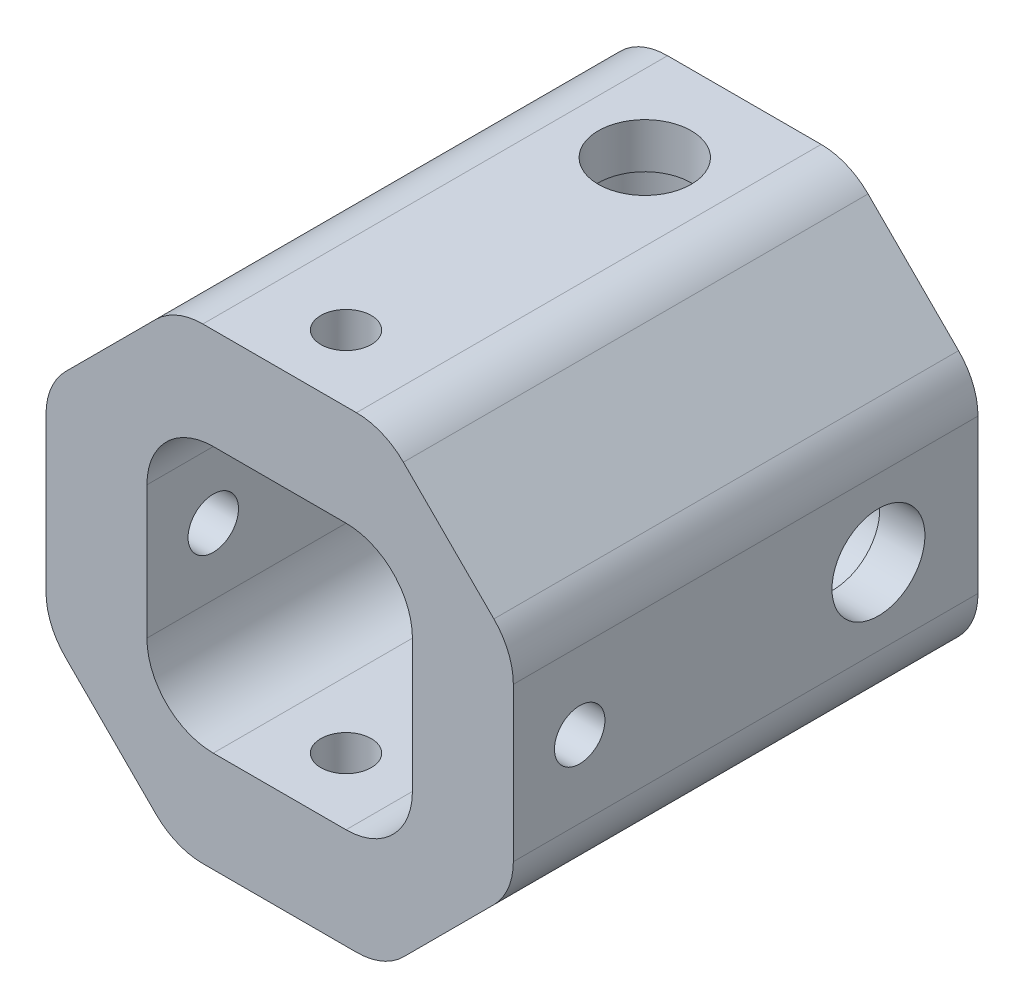
from build123d import *

# Parameters (mm, degrees)
EXTRUDE_1_DEPTH          = 7.5
CUT_EXTRUDE_1_DEPTH      = 30.546573405
CUT_EXTRUDE_1_DEPTH_BACK = 30.546573405
SKETCH_2_W               = 20
SKETCH_2_H               = 20
SKETCH_11_W              = 29.504788154
SKETCH_11_H              = 47.493911142
CUT_EXTRUDE_7_DEPTH      = 0.4
SKETCH_12_W              = 20.237973212
SKETCH_12_H              = 25.719397838
CUT_EXTRUDE_8_DEPTH      = 0.4
FILLET_1_R               = 5
FILLET_2_R               = 5
CUT_EXTRUDE_2_DEPTH      = 41.063075269
CUT_EXTRUDE_2_DEPTH_BACK = 41.063075269
SKETCH_3_R               = 4.2
CUT_EXTRUDE_3_DEPTH      = 41.063075269
CUT_EXTRUDE_3_DEPTH_BACK = 41.063075269
SKETCH_4_R               = 4.2
EXTRUDE_2_DEPTH          = 20
SKETCH_6_R               = 4.2
SKETCH_6_R_2             = 3.5
EXTRUDE_3_DEPTH          = 3.4
EXTRUDE_START            = -3.4
SKETCH_13_R              = 4.2
SKETCH_13_R_2            = 3.5
EXTRUDE_4_DEPTH          = 3.4
SKETCH_14_R              = 1.9
CUT_EXTRUDE_9_DEPTH      = 49.010936254
SKETCH_15_R              = 1.9
CUT_EXTRUDE_10_DEPTH     = 49.010936254


with BuildPart() as part:
    # ｽｹｯﾁ1 → ﾎﾞｽ - 押し出し1 (new, symmetric)
    with BuildSketch(Plane.XY):
        Polygon((7.455844123, -18), (18, -7.455844123), (18, 7.455844123), (7.455844123, 18), (-7.455844123, 18), (-18, 7.455844123), (-18, -7.455844123), (-7.455844123, -18), align=None)
    extrude(amount=EXTRUDE_1_DEPTH, both=True)

    # ｽｹｯﾁ2 → ｶｯﾄ - 押し出し1 (cut, two sides: drawn at the far end of the back side and taken through both)
    with BuildSketch(Plane.XY.offset(7.5).offset(-CUT_EXTRUDE_1_DEPTH_BACK)):
        Rectangle(SKETCH_2_W, SKETCH_2_H)
    extrude(amount=CUT_EXTRUDE_1_DEPTH + CUT_EXTRUDE_1_DEPTH_BACK, mode=Mode.SUBTRACT)

    # ｽｹｯﾁ11 → ｶｯﾄ - 押し出し7 (cut)
    with BuildSketch(Plane(origin=(0, 18, 0), x_dir=(1, 0, 0), z_dir=(0, 1, 0))):
        Rectangle(SKETCH_11_W, SKETCH_11_H)
    cut_extrude_7 = extrude(amount=-CUT_EXTRUDE_7_DEPTH, mode=Mode.SUBTRACT)

    # ﾐﾗｰ1: ｶｯﾄ - 押し出し7 across plane
    add(cut_extrude_7.mirror(Plane.ZX), mode=Mode.SUBTRACT)

    # ｽｹｯﾁ12 → ｶｯﾄ - 押し出し8 (cut)
    with BuildSketch(Plane.ZY.offset(18)):
        Rectangle(SKETCH_12_W, SKETCH_12_H)
    cut_extrude_8 = extrude(amount=-CUT_EXTRUDE_8_DEPTH, mode=Mode.SUBTRACT)

    # ﾐﾗｰ2: ｶｯﾄ - 押し出し8 across plane
    add(cut_extrude_8.mirror(Plane(origin=(0, 0, 0), x_dir=(0, 0, 1), z_dir=(1, 0, 0))), mode=Mode.SUBTRACT)

    # ﾌｨﾚｯﾄ1
    fillet_1_edges = [part.edges().sort_by_distance(p)[0] for p in [
        (-10, -10, 0),
        (-10, 10, 0),
        (10, 10, 0),
        (10, -10, 0),
    ]]
    fillet(fillet_1_edges, radius=FILLET_1_R)

    # ﾌｨﾚｯﾄ2
    fillet_2_edges = [part.edges().sort_by_distance(p)[0] for p in [
        (17.6, 7.855844123, 0),
        (17.6, -7.855844123, 0),
        (-7.855844123, 17.6, 0),
        (7.855844123, 17.6, 0),
        (7.855844123, -17.6, 0),
        (-7.855844123, -17.6, 0),
        (-17.6, -7.855844123, 0),
        (-17.6, 7.855844123, 0),
    ]]
    fillet(fillet_2_edges, radius=FILLET_2_R)

    # ｽｹｯﾁ3 → ｶｯﾄ - 押し出し2 (cut, two sides: drawn at the far end of the back side and taken through both)
    with BuildSketch(Plane.XZ.offset(17.6).offset(-CUT_EXTRUDE_2_DEPTH_BACK)):
        with Locations(Location((0, 0, 0), (0, 0, 270))):
            Circle(SKETCH_3_R)
    extrude(amount=CUT_EXTRUDE_2_DEPTH + CUT_EXTRUDE_2_DEPTH_BACK, mode=Mode.SUBTRACT)

    # ｽｹｯﾁ4 → ｶｯﾄ - 押し出し3 (cut, two sides: drawn at the far end of the back side and taken through both)
    with BuildSketch(Plane(origin=(17.6, 0, 0), x_dir=(0, 0, -1), z_dir=(1, 0, 0)).offset(-CUT_EXTRUDE_3_DEPTH_BACK)):
        Circle(SKETCH_4_R)
    extrude(amount=CUT_EXTRUDE_3_DEPTH + CUT_EXTRUDE_3_DEPTH_BACK, mode=Mode.SUBTRACT)

    # ｽｹｯﾁ5 → ﾎﾞｽ - 押し出し2 (add)
    with BuildSketch(Plane.XY.offset(7.5)):
        with BuildLine():
            Line((17.6, -5.784776311), (17.6, 5.784776311))
            ThreePointArc((17.6, 5.784776311), (17.219397663, 7.698193473), (16.135533906, 9.320310217))
            Line((16.135533906, 9.320310217), (9.320310217, 16.135533906))
            ThreePointArc((9.320310217, 16.135533906), (7.698193473, 17.219397663), (5.784776311, 17.6))
            Line((5.784776311, 17.6), (-5.784776311, 17.6))
            ThreePointArc((-5.784776311, 17.6), (-7.698193473, 17.219397663), (-9.320310217, 16.135533906))
            Line((-9.320310217, 16.135533906), (-16.135533906, 9.320310217))
            ThreePointArc((-16.135533906, 9.320310217), (-17.219397663, 7.698193473), (-17.6, 5.784776311))
            Line((-17.6, 5.784776311), (-17.6, -5.784776311))
            ThreePointArc((-17.6, -5.784776311), (-17.219397663, -7.698193473), (-16.135533906, -9.320310217))
            Line((-16.135533906, -9.320310217), (-9.320310217, -16.135533906))
            ThreePointArc((-9.320310217, -16.135533906), (-7.698193473, -17.219397663), (-5.784776311, -17.6))
            Line((-5.784776311, -17.6), (5.784776311, -17.6))
            ThreePointArc((5.784776311, -17.6), (7.698193473, -17.219397663), (9.320310217, -16.135533906))
            Line((9.320310217, -16.135533906), (16.135533906, -9.320310217))
            ThreePointArc((16.135533906, -9.320310217), (17.219397663, -7.698193473), (17.6, -5.784776311))
        make_face()
        with BuildLine():
            Line((5, 10), (-5, 10))
            ThreePointArc((-5, 10), (-8.535533906, 8.535533906), (-10, 5))
            Line((-10, 5), (-10, -5))
            ThreePointArc((-10, -5), (-8.535533906, -8.535533906), (-5, -10))
            Line((-5, -10), (5, -10))
            ThreePointArc((5, -10), (8.535533906, -8.535533906), (10, -5))
            Line((10, -5), (10, 5))
            ThreePointArc((10, 5), (8.535533906, 8.535533906), (5, 10))
        make_face(mode=Mode.SUBTRACT)
    extrude(amount=EXTRUDE_2_DEPTH)

    # ｽｹｯﾁ6 → ﾎﾞｽ - 押し出し3 (add)
    with BuildSketch(Plane.XZ.offset(17.6)):
        Circle(SKETCH_6_R)
        Circle(SKETCH_6_R_2, mode=Mode.SUBTRACT)
    extrude_3 = extrude(amount=-EXTRUDE_3_DEPTH)

    # ﾐﾗｰ3: ﾎﾞｽ - 押し出し3 across plane
    add(extrude_3.mirror(Plane.ZX))

    # ｽｹｯﾁ13 → ﾎﾞｽ - 押し出し4 (add)
    with BuildSketch(Plane.ZY.offset(17.6).offset(EXTRUDE_START)):
        Circle(SKETCH_13_R)
        Circle(SKETCH_13_R_2, mode=Mode.SUBTRACT)
    extrude_4 = extrude(amount=EXTRUDE_4_DEPTH)

    # ﾐﾗｰ4: ﾎﾞｽ - 押し出し4 across plane
    add(extrude_4.mirror(Plane(origin=(0, 0, 0), x_dir=(0, 0, 1), z_dir=(1, 0, 0))))

    # ｽｹｯﾁ14 → ｶｯﾄ - 押し出し9 (cut, through all)
    with BuildSketch(Plane.ZY.offset(17.6)):
        with Locations((22.5, 0)):
            Circle(SKETCH_14_R)
    extrude(amount=-CUT_EXTRUDE_9_DEPTH, mode=Mode.SUBTRACT)

    # ｽｹｯﾁ15 → ｶｯﾄ - 押し出し10 (cut, through all)
    with BuildSketch(Plane.XZ.offset(17.6)):
        with Locations((0, 22.5)):
            Circle(SKETCH_15_R)
    extrude(amount=-CUT_EXTRUDE_10_DEPTH, mode=Mode.SUBTRACT)


solid = part.part
